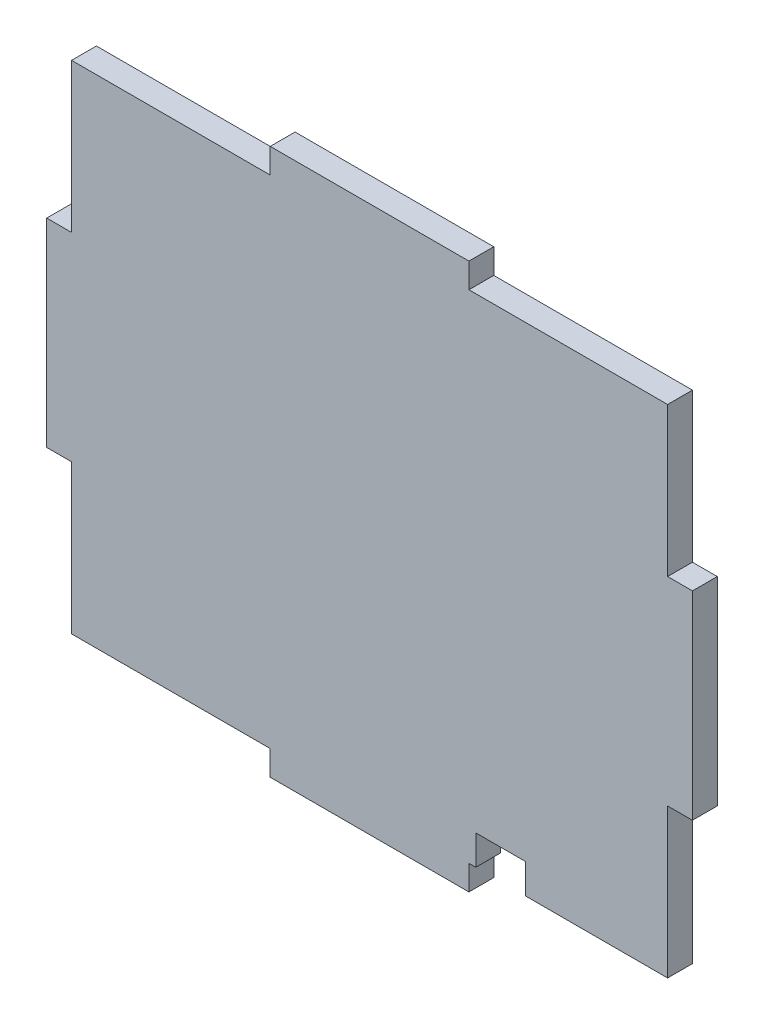
from build123d import *

# Parameters (mm, degrees)
BOSS_EXTRUDE1_DEPTH = 1.25


with BuildPart() as part:
    # Sketch1 → Boss-Extrude1 (new, symmetric)
    with BuildSketch(Plane.XY):
        Polygon((-30, 10), (-32.5, 10), (-32.5, -10), (-30, -10), (-30, -25), (-10, -25), (-10, -27.5), (10, -27.5), (10, -25), (10.69, -25), (10.69, -22), (15.69, -22), (15.69, -25), (30, -25), (30, -10), (32.5, -10), (32.5, 10), (30, 10), (30, 25), (10, 25), (10, 27.5), (-10, 27.5), (-10, 25), (-30, 25), align=None)
    extrude(amount=BOSS_EXTRUDE1_DEPTH, both=True)


solid = part.part
